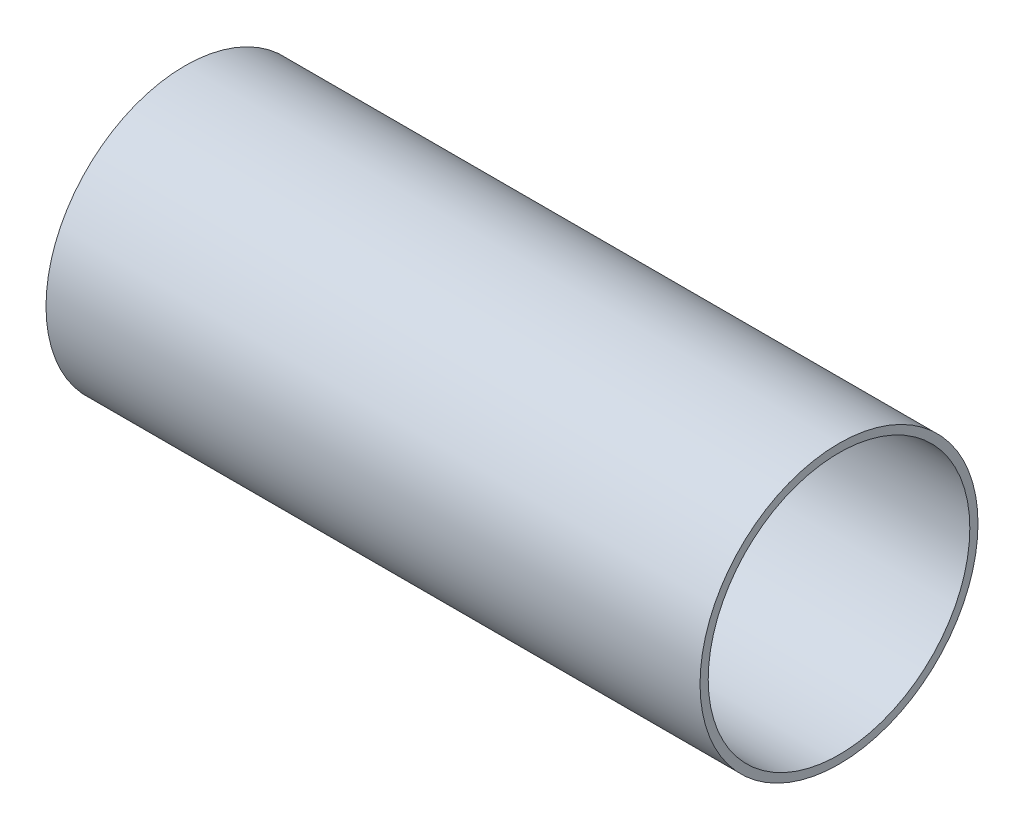
from build123d import *

# Parameters (mm, degrees)
SKETCH1_W = 20
SKETCH1_H = 0.25


with BuildPart() as part:
    # Sketch1 → Revolve2 (revolve)
    with BuildSketch(Plane(origin=(0, 0, 0), x_dir=(1, 0, 0), z_dir=(0, 1, 0))):
        with Locations((-10, 4.125)):
            Rectangle(SKETCH1_W, SKETCH1_H)
    revolve(axis=Axis((0, 0, 0), (-1, 0, 0)))


solid = part.part
